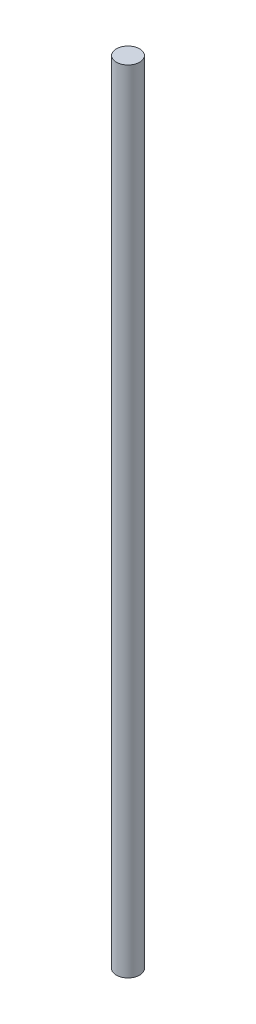
from build123d import *

# Parameters (mm, degrees)
SKETCH_1_R      = 2.5
EXTRUDE_1_DEPTH = 170


with BuildPart() as part:
    # 草图1 → 凸台-拉伸1 (new body)
    with BuildSketch(Plane(origin=(0, 0, 0), x_dir=(1, 0, 0), z_dir=(0, 1, 0))):
        with Locations(Location((-10.341143258, 6.947955626, 0), (0, 0, 270))):
            Circle(SKETCH_1_R)
    extrude(amount=EXTRUDE_1_DEPTH)


solid = part.part
